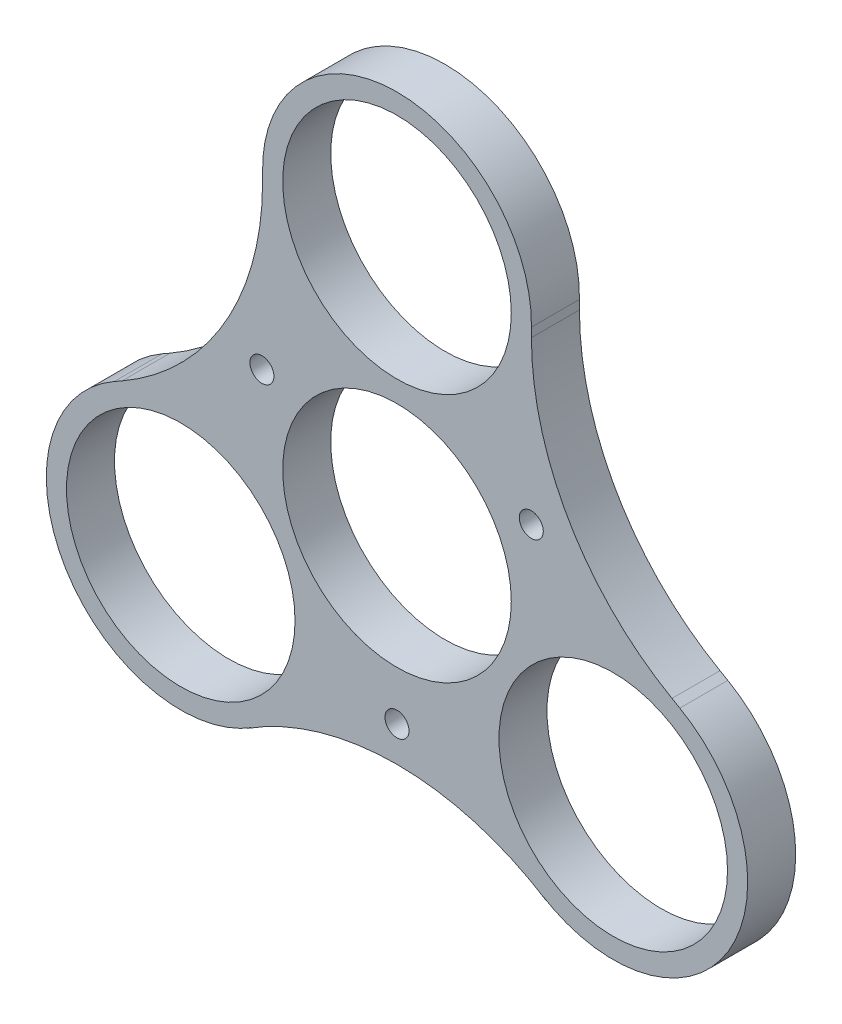
from build123d import *

# Parameters (mm, degrees)
SKETCH1_R           = 11.9
SKETCH1_R_2         = 1.25
BOSS_EXTRUDE1_DEPTH = 2.5


with BuildPart() as part:
    # Sketch1 → Boss-Extrude1 (new, symmetric)
    with BuildSketch(Plane.XY):
        with BuildLine():
            Line((13.998405034, 25.788679153), (13.997620563, 24.84501718))
            ThreePointArc((13.997620563, 24.84501718), (17.915653408, 10.264281088), (28.632025365, -0.370953675))
            Line((28.632025365, -0.370953675), (29.451770584, -0.838410955))
            ThreePointArc((29.451770584, -0.838410955), (34.50421589, -20.231771272), (14.992592767, -24.806286663))
            Line((14.992592767, -24.806286663), (15.585568871, -25.184186379))
            ThreePointArc((15.585568871, -25.184186379), (0, -20.640065896), (-15.585568871, -25.184186379))
            Line((-15.585568871, -25.184186379), (-14.992592767, -24.806286663))
            ThreePointArc((-14.992592767, -24.806286663), (-34.504073282, -20.232007658), (-29.452250217, -0.838684477))
            Line((-29.452250217, -0.838684477), (-28.632523434, -0.371194867))
            ThreePointArc((-28.632523434, -0.371194867), (-17.951478652, 10.204474397), (-13.999324478, 24.706542367))
            Line((-13.999324478, 24.706542367), (-13.995629252, 25.650197431))
            ThreePointArc((-13.995629252, 25.650197431), (-0.069254769, 39.999828705), (13.998405034, 25.788679153))
        make_face()
        Circle(SKETCH1_R, mode=Mode.SUBTRACT)
        with Locations((0, 26)):
            Circle(SKETCH1_R, mode=Mode.SUBTRACT)
        with Locations((22.516660498, -13)):
            Circle(SKETCH1_R, mode=Mode.SUBTRACT)
        with Locations((-22.516660498, -13)):
            Circle(SKETCH1_R, mode=Mode.SUBTRACT)
        with Locations((13.983602476, 7.982266036)):
            Circle(SKETCH1_R_2, mode=Mode.SUBTRACT)
        with Locations((0, -17)):
            Circle(SKETCH1_R_2, mode=Mode.SUBTRACT)
        with Locations((-14.064993078, 7.936657484)):
            Circle(SKETCH1_R_2, mode=Mode.SUBTRACT)
    extrude(amount=BOSS_EXTRUDE1_DEPTH, both=True)


solid = part.part
